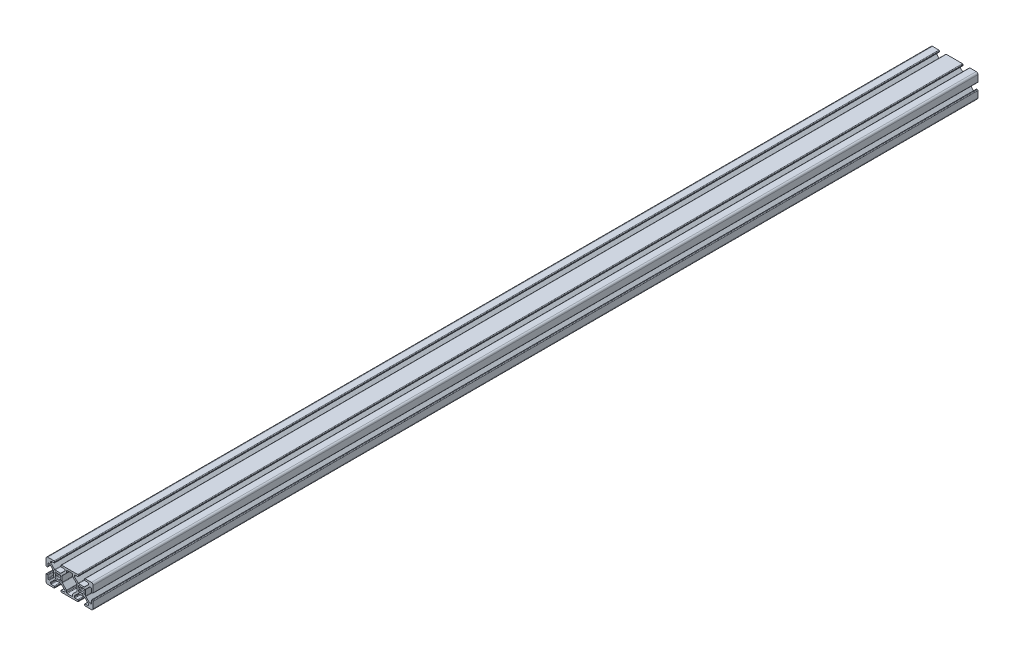
from build123d import *

# Parameters (mm, degrees)
EXTRUDE1_DEPTH = 750


with BuildPart() as part:
    # Sketch1 → Extrude1 (new body)
    with BuildSketch(Plane.XY):
        with BuildLine():
            Line((-36.908207136, -63.334998016), (-32.140368459, -63.334998016))
            ThreePointArc((-32.140368459, -63.334998016), (-31.945965275, -63.373667213), (-31.781158214, -63.483787771))
            Line((-31.781158214, -63.483787771), (-28.678077553, -66.586868432))
            ThreePointArc((-28.678077553, -66.586868432), (-28.567956995, -66.751675493), (-28.529287798, -66.946078677))
            Line((-28.529287798, -66.946078677), (-28.529287798, -67.671998016))
            ThreePointArc((-28.529287798, -67.671998016), (-28.678077553, -68.03120826), (-29.037287798, -68.179998016))
            Line((-29.037287798, -68.179998016), (-31.386287798, -68.179998016))
            ThreePointArc((-31.386287798, -68.179998016), (-31.745498042, -68.328787771), (-31.894287798, -68.687998016))
            Line((-31.894287798, -68.687998016), (-31.894287798, -69.171998016))
            ThreePointArc((-31.894287798, -69.171998016), (-31.745498042, -69.53120826), (-31.386287798, -69.679998016))
            Line((-31.386287798, -69.679998016), (-17.662287798, -69.679998016))
            ThreePointArc((-17.662287798, -69.679998016), (-17.303077553, -69.53120826), (-17.154287798, -69.171998016))
            Line((-17.154287798, -69.171998016), (-17.154287798, -68.687998016))
            ThreePointArc((-17.154287798, -68.687998016), (-17.303077553, -68.328787771), (-17.662287798, -68.179998016))
            Line((-17.662287798, -68.179998016), (-20.011287798, -68.179998016))
            ThreePointArc((-20.011287798, -68.179998016), (-20.370498042, -68.03120826), (-20.519287798, -67.671998016))
            Line((-20.519287798, -67.671998016), (-20.519287798, -66.946078677))
            ThreePointArc((-20.519287798, -66.946078677), (-20.4806186, -66.751675493), (-20.370498042, -66.586868432))
            Line((-20.370498042, -66.586868432), (-17.267417381, -63.483787771))
            ThreePointArc((-17.267417381, -63.483787771), (-17.10261032, -63.373667213), (-16.908207136, -63.334998016))
            Line((-16.908207136, -63.334998016), (-12.140368459, -63.334998016))
            ThreePointArc((-12.140368459, -63.334998016), (-11.945965275, -63.373667213), (-11.781158214, -63.483787771))
            Line((-11.781158214, -63.483787771), (-8.678077553, -66.586868432))
            ThreePointArc((-8.678077553, -66.586868432), (-8.567956995, -66.751675493), (-8.529287798, -66.946078677))
            Line((-8.529287798, -66.946078677), (-8.529287798, -67.671998016))
            ThreePointArc((-8.529287798, -67.671998016), (-8.678077553, -68.03120826), (-9.037287798, -68.179998016))
            Line((-9.037287798, -68.179998016), (-11.386287798, -68.179998016))
            ThreePointArc((-11.386287798, -68.179998016), (-11.745498042, -68.328787771), (-11.894287798, -68.687998016))
            Line((-11.894287798, -68.687998016), (-11.894287798, -69.171998016))
            ThreePointArc((-11.894287798, -69.171998016), (-11.745498042, -69.53120826), (-11.386287798, -69.679998016))
            Line((-11.386287798, -69.679998016), (-6.024287798, -69.679998016))
            ThreePointArc((-6.024287798, -69.679998016), (-4.963627626, -69.240658187), (-4.524287798, -68.179998016))
            Line((-4.524287798, -68.179998016), (-4.524287798, -62.817998016))
            ThreePointArc((-4.524287798, -62.817998016), (-4.673077553, -62.458787771), (-5.032287798, -62.309998016))
            Line((-5.032287798, -62.309998016), (-5.516287798, -62.309998016))
            ThreePointArc((-5.516287798, -62.309998016), (-5.875498042, -62.458787771), (-6.024287798, -62.817998016))
            Line((-6.024287798, -62.817998016), (-6.024287798, -65.166998016))
            ThreePointArc((-6.024287798, -65.166998016), (-6.173077553, -65.52620826), (-6.532287798, -65.674998016))
            Line((-6.532287798, -65.674998016), (-7.258207136, -65.674998016))
            ThreePointArc((-7.258207136, -65.674998016), (-7.45261032, -65.636328818), (-7.617417381, -65.52620826))
            Line((-7.617417381, -65.52620826), (-10.720498042, -62.423127599))
            ThreePointArc((-10.720498042, -62.423127599), (-10.8306186, -62.258320538), (-10.869287798, -62.063917354))
            Line((-10.869287798, -62.063917354), (-10.869287798, -57.296078677))
            ThreePointArc((-10.869287798, -57.296078677), (-10.8306186, -57.101675493), (-10.720498042, -56.936868432))
            Line((-10.720498042, -56.936868432), (-7.617417381, -53.833787771))
            ThreePointArc((-7.617417381, -53.833787771), (-7.45261032, -53.723667213), (-7.258207136, -53.684998016))
            Line((-7.258207136, -53.684998016), (-6.532287798, -53.684998016))
            ThreePointArc((-6.532287798, -53.684998016), (-6.173077553, -53.833787771), (-6.024287798, -54.192998016))
            Line((-6.024287798, -54.192998016), (-6.024287798, -56.541998016))
            ThreePointArc((-6.024287798, -56.541998016), (-5.875498042, -56.90120826), (-5.516287798, -57.049998016))
            Line((-5.516287798, -57.049998016), (-5.032287798, -57.049998016))
            ThreePointArc((-5.032287798, -57.049998016), (-4.673077553, -56.90120826), (-4.524287798, -56.541998016))
            Line((-4.524287798, -56.541998016), (-4.524287798, -51.179998016))
            ThreePointArc((-4.524287798, -51.179998016), (-4.963627626, -50.119337844), (-6.024287798, -49.679998016))
            Line((-6.024287798, -49.679998016), (-11.386287798, -49.679998016))
            ThreePointArc((-11.386287798, -49.679998016), (-11.745498042, -49.828787771), (-11.894287798, -50.187998016))
            Line((-11.894287798, -50.187998016), (-11.894287798, -50.671998016))
            ThreePointArc((-11.894287798, -50.671998016), (-11.745498042, -51.03120826), (-11.386287798, -51.179998016))
            Line((-11.386287798, -51.179998016), (-9.037287798, -51.179998016))
            ThreePointArc((-9.037287798, -51.179998016), (-8.678077553, -51.328787771), (-8.529287798, -51.687998016))
            Line((-8.529287798, -51.687998016), (-8.529287798, -52.413917354))
            ThreePointArc((-8.529287798, -52.413917354), (-8.567956995, -52.608320538), (-8.678077553, -52.773127599))
            Line((-8.678077553, -52.773127599), (-11.781158214, -55.87620826))
            ThreePointArc((-11.781158214, -55.87620826), (-11.945965275, -55.986328818), (-12.140368459, -56.024998016))
            Line((-12.140368459, -56.024998016), (-16.908207136, -56.024998016))
            ThreePointArc((-16.908207136, -56.024998016), (-17.10261032, -55.986328818), (-17.267417381, -55.87620826))
            Line((-17.267417381, -55.87620826), (-20.370498042, -52.773127599))
            ThreePointArc((-20.370498042, -52.773127599), (-20.4806186, -52.608320538), (-20.519287798, -52.413917354))
            Line((-20.519287798, -52.413917354), (-20.519287798, -51.687998016))
            ThreePointArc((-20.519287798, -51.687998016), (-20.370498042, -51.328787771), (-20.011287798, -51.179998016))
            Line((-20.011287798, -51.179998016), (-17.662287798, -51.179998016))
            ThreePointArc((-17.662287798, -51.179998016), (-17.303077553, -51.03120826), (-17.154287798, -50.671998016))
            Line((-17.154287798, -50.671998016), (-17.154287798, -50.187998016))
            ThreePointArc((-17.154287798, -50.187998016), (-17.303077553, -49.828787771), (-17.662287798, -49.679998016))
            Line((-17.662287798, -49.679998016), (-31.386287798, -49.679998016))
            ThreePointArc((-31.386287798, -49.679998016), (-31.745498042, -49.828787771), (-31.894287798, -50.187998016))
            Line((-31.894287798, -50.187998016), (-31.894287798, -50.671998016))
            ThreePointArc((-31.894287798, -50.671998016), (-31.745498042, -51.03120826), (-31.386287798, -51.179998016))
            Line((-31.386287798, -51.179998016), (-29.037287798, -51.179998016))
            ThreePointArc((-29.037287798, -51.179998016), (-28.678077553, -51.328787771), (-28.529287798, -51.687998016))
            Line((-28.529287798, -51.687998016), (-28.529287798, -52.413917354))
            ThreePointArc((-28.529287798, -52.413917354), (-28.567956995, -52.608320538), (-28.678077553, -52.773127599))
            Line((-28.678077553, -52.773127599), (-31.781158214, -55.87620826))
            ThreePointArc((-31.781158214, -55.87620826), (-31.945965275, -55.986328818), (-32.140368459, -56.024998016))
            Line((-32.140368459, -56.024998016), (-36.908207136, -56.024998016))
            ThreePointArc((-36.908207136, -56.024998016), (-37.10261032, -55.986328818), (-37.267417381, -55.87620826))
            Line((-37.267417381, -55.87620826), (-40.370498042, -52.773127599))
            ThreePointArc((-40.370498042, -52.773127599), (-40.4806186, -52.608320538), (-40.519287798, -52.413917354))
            Line((-40.519287798, -52.413917354), (-40.519287798, -51.687998016))
            ThreePointArc((-40.519287798, -51.687998016), (-40.370498042, -51.328787771), (-40.011287798, -51.179998016))
            Line((-40.011287798, -51.179998016), (-37.662287798, -51.179998016))
            ThreePointArc((-37.662287798, -51.179998016), (-37.303077553, -51.03120826), (-37.154287798, -50.671998016))
            Line((-37.154287798, -50.671998016), (-37.154287798, -50.187998016))
            ThreePointArc((-37.154287798, -50.187998016), (-37.303077553, -49.828787771), (-37.662287798, -49.679998016))
            Line((-37.662287798, -49.679998016), (-43.024287798, -49.679998016))
            ThreePointArc((-43.024287798, -49.679998016), (-44.084947969, -50.119337844), (-44.524287798, -51.179998016))
            Line((-44.524287798, -51.179998016), (-44.524287798, -56.541998016))
            ThreePointArc((-44.524287798, -56.541998016), (-44.375498042, -56.90120826), (-44.016287798, -57.049998016))
            Line((-44.016287798, -57.049998016), (-43.532287798, -57.049998016))
            ThreePointArc((-43.532287798, -57.049998016), (-43.173077553, -56.90120826), (-43.024287798, -56.541998016))
            Line((-43.024287798, -56.541998016), (-43.024287798, -54.192998016))
            ThreePointArc((-43.024287798, -54.192998016), (-42.875498042, -53.833787771), (-42.516287798, -53.684998016))
            Line((-42.516287798, -53.684998016), (-41.790368459, -53.684998016))
            ThreePointArc((-41.790368459, -53.684998016), (-41.595965275, -53.723667213), (-41.431158214, -53.833787771))
            Line((-41.431158214, -53.833787771), (-38.328077553, -56.936868432))
            ThreePointArc((-38.328077553, -56.936868432), (-38.217956995, -57.101675493), (-38.179287798, -57.296078677))
            Line((-38.179287798, -57.296078677), (-38.179287798, -62.063917354))
            ThreePointArc((-38.179287798, -62.063917354), (-38.217956995, -62.258320538), (-38.328077553, -62.423127599))
            Line((-38.328077553, -62.423127599), (-41.431158214, -65.52620826))
            ThreePointArc((-41.431158214, -65.52620826), (-41.595965275, -65.636328818), (-41.790368459, -65.674998016))
            Line((-41.790368459, -65.674998016), (-42.516287798, -65.674998016))
            ThreePointArc((-42.516287798, -65.674998016), (-42.875498042, -65.52620826), (-43.024287798, -65.166998016))
            Line((-43.024287798, -65.166998016), (-43.024287798, -62.817998016))
            ThreePointArc((-43.024287798, -62.817998016), (-43.173077553, -62.458787771), (-43.532287798, -62.309998016))
            Line((-43.532287798, -62.309998016), (-44.016287798, -62.309998016))
            ThreePointArc((-44.016287798, -62.309998016), (-44.375498042, -62.458787771), (-44.524287798, -62.817998016))
            Line((-44.524287798, -62.817998016), (-44.524287798, -68.179998016))
            ThreePointArc((-44.524287798, -68.179998016), (-44.084947969, -69.240658187), (-43.024287798, -69.679998016))
            Line((-43.024287798, -69.679998016), (-37.662287798, -69.679998016))
            ThreePointArc((-37.662287798, -69.679998016), (-37.303077553, -69.53120826), (-37.154287798, -69.171998016))
            Line((-37.154287798, -69.171998016), (-37.154287798, -68.687998016))
            ThreePointArc((-37.154287798, -68.687998016), (-37.303077553, -68.328787771), (-37.662287798, -68.179998016))
            Line((-37.662287798, -68.179998016), (-40.011287798, -68.179998016))
            ThreePointArc((-40.011287798, -68.179998016), (-40.370498042, -68.03120826), (-40.519287798, -67.671998016))
            Line((-40.519287798, -67.671998016), (-40.519287798, -66.946078677))
            ThreePointArc((-40.519287798, -66.946078677), (-40.4806186, -66.751675493), (-40.370498042, -66.586868432))
            Line((-40.370498042, -66.586868432), (-37.267417381, -63.483787771))
            ThreePointArc((-37.267417381, -63.483787771), (-37.10261032, -63.373667213), (-36.908207136, -63.334998016))
        make_face()
        with BuildLine():
            Line((-16.649188641, -61.984503982), (-16.828793764, -61.804898859))
            ThreePointArc((-16.828793764, -61.804898859), (-17.030225814, -61.036465826), (-16.459421304, -60.483974734))
            ThreePointArc((-16.459421304, -60.483974734), (-16.619787798, -59.679998016), (-16.459421304, -58.876021298))
            ThreePointArc((-16.459421304, -58.876021298), (-17.030225814, -58.323530205), (-16.828793764, -57.555097172))
            Line((-16.828793764, -57.555097172), (-16.649188641, -57.375492049))
            ThreePointArc((-16.649188641, -57.375492049), (-15.880755608, -57.174059999), (-15.328264516, -57.744864509))
            ThreePointArc((-15.328264516, -57.744864509), (-14.524287798, -57.584498016), (-13.72031108, -57.744864509))
            ThreePointArc((-13.72031108, -57.744864509), (-13.167819987, -57.174059999), (-12.399386954, -57.375492049))
            Line((-12.399386954, -57.375492049), (-12.219781831, -57.555097172))
            ThreePointArc((-12.219781831, -57.555097172), (-12.018349781, -58.323530205), (-12.589154291, -58.876021298))
            ThreePointArc((-12.589154291, -58.876021298), (-12.428787798, -59.679998016), (-12.589154291, -60.483974734))
            ThreePointArc((-12.589154291, -60.483974734), (-12.018349781, -61.036465826), (-12.219781831, -61.804898859))
            Line((-12.219781831, -61.804898859), (-12.399386954, -61.984503982))
            ThreePointArc((-12.399386954, -61.984503982), (-13.167819987, -62.185936032), (-13.72031108, -61.615131522))
            ThreePointArc((-13.72031108, -61.615131522), (-14.524287798, -61.775498016), (-15.328264516, -61.615131522))
            ThreePointArc((-15.328264516, -61.615131522), (-15.880755608, -62.185936032), (-16.649188641, -61.984503982))
        make_face(mode=Mode.SUBTRACT)
        with BuildLine():
            Line((-27.029287798, -67.671998016), (-27.029287798, -66.324758333))
            ThreePointArc((-27.029287798, -66.324758333), (-27.067956995, -66.13035515), (-27.178077553, -65.965548089))
            Line((-27.178077553, -65.965548089), (-30.720498042, -62.423127599))
            ThreePointArc((-30.720498042, -62.423127599), (-30.8306186, -62.258320538), (-30.869287798, -62.063917354))
            Line((-30.869287798, -62.063917354), (-30.869287798, -57.296078677))
            ThreePointArc((-30.869287798, -57.296078677), (-30.8306186, -57.101675493), (-30.720498042, -56.936868432))
            Line((-30.720498042, -56.936868432), (-27.178077553, -53.394447942))
            ThreePointArc((-27.178077553, -53.394447942), (-27.067956995, -53.229640881), (-27.029287798, -53.035237698))
            Line((-27.029287798, -53.035237698), (-27.029287798, -51.687998016))
            ThreePointArc((-27.029287798, -51.687998016), (-26.880498042, -51.328787771), (-26.521287798, -51.179998016))
            Line((-26.521287798, -51.179998016), (-22.527287798, -51.179998016))
            ThreePointArc((-22.527287798, -51.179998016), (-22.168077553, -51.328787771), (-22.019287798, -51.687998016))
            Line((-22.019287798, -51.687998016), (-22.019287798, -53.035237698))
            ThreePointArc((-22.019287798, -53.035237698), (-21.9806186, -53.229640881), (-21.870498042, -53.394447942))
            Line((-21.870498042, -53.394447942), (-18.328077553, -56.936868432))
            ThreePointArc((-18.328077553, -56.936868432), (-18.217956995, -57.101675493), (-18.179287798, -57.296078677))
            Line((-18.179287798, -57.296078677), (-18.179287798, -62.063917354))
            ThreePointArc((-18.179287798, -62.063917354), (-18.217956995, -62.258320538), (-18.328077553, -62.423127599))
            Line((-18.328077553, -62.423127599), (-21.870498042, -65.965548089))
            ThreePointArc((-21.870498042, -65.965548089), (-21.9806186, -66.13035515), (-22.019287798, -66.324758333))
            Line((-22.019287798, -66.324758333), (-22.019287798, -67.671998016))
            ThreePointArc((-22.019287798, -67.671998016), (-22.168077553, -68.03120826), (-22.527287798, -68.179998016))
            Line((-22.527287798, -68.179998016), (-26.521287798, -68.179998016))
            ThreePointArc((-26.521287798, -68.179998016), (-26.880498042, -68.03120826), (-27.029287798, -67.671998016))
        make_face(mode=Mode.SUBTRACT)
        with BuildLine():
            Line((-36.649188641, -61.984503982), (-36.828793764, -61.804898859))
            ThreePointArc((-36.828793764, -61.804898859), (-37.030225814, -61.036465826), (-36.459421304, -60.483974734))
            ThreePointArc((-36.459421304, -60.483974734), (-36.619787798, -59.679998016), (-36.459421304, -58.876021298))
            ThreePointArc((-36.459421304, -58.876021298), (-37.030225814, -58.323530205), (-36.828793764, -57.555097172))
            Line((-36.828793764, -57.555097172), (-36.649188641, -57.375492049))
            ThreePointArc((-36.649188641, -57.375492049), (-35.880755608, -57.174059999), (-35.328264516, -57.744864509))
            ThreePointArc((-35.328264516, -57.744864509), (-34.524287798, -57.584498016), (-33.72031108, -57.744864509))
            ThreePointArc((-33.72031108, -57.744864509), (-33.167819987, -57.174059999), (-32.399386954, -57.375492049))
            Line((-32.399386954, -57.375492049), (-32.219781831, -57.555097172))
            ThreePointArc((-32.219781831, -57.555097172), (-32.018349781, -58.323530205), (-32.589154291, -58.876021298))
            ThreePointArc((-32.589154291, -58.876021298), (-32.428787798, -59.679998016), (-32.589154291, -60.483974734))
            ThreePointArc((-32.589154291, -60.483974734), (-32.018349781, -61.036465826), (-32.219781831, -61.804898859))
            Line((-32.219781831, -61.804898859), (-32.399386954, -61.984503982))
            ThreePointArc((-32.399386954, -61.984503982), (-33.167819987, -62.185936032), (-33.72031108, -61.615131522))
            ThreePointArc((-33.72031108, -61.615131522), (-34.524287798, -61.775498016), (-35.328264516, -61.615131522))
            ThreePointArc((-35.328264516, -61.615131522), (-35.880755608, -62.185936032), (-36.649188641, -61.984503982))
        make_face(mode=Mode.SUBTRACT)
    extrude(amount=EXTRUDE1_DEPTH)


solid = part.part
